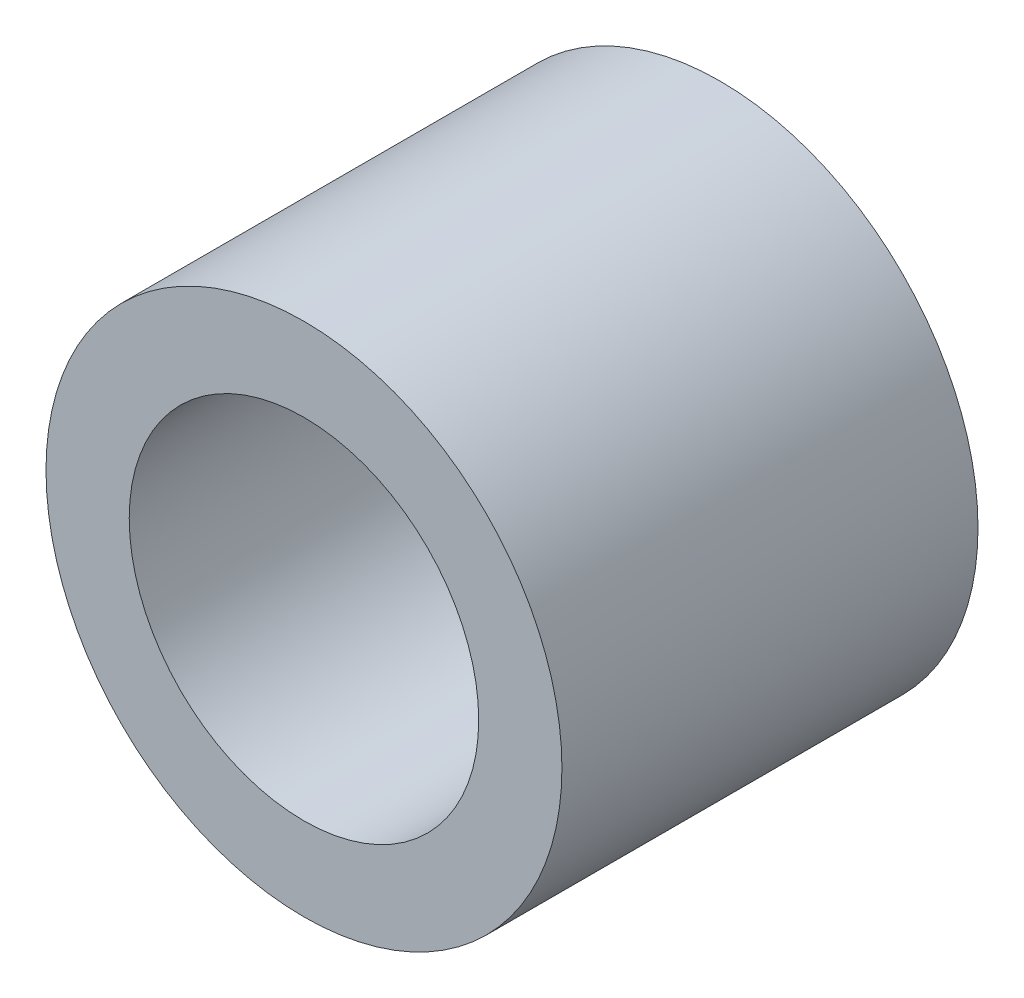
from build123d import *

# Parameters (mm, degrees)
SKETCH1_R           = 3.1
SKETCH1_R_2         = 2.1
BOSS_EXTRUDE1_DEPTH = 2.5


with BuildPart() as part:
    # Sketch1 → Boss-Extrude1 (new, symmetric)
    with BuildSketch(Plane.XY):
        Circle(SKETCH1_R)
        Circle(SKETCH1_R_2, mode=Mode.SUBTRACT)
    extrude(amount=BOSS_EXTRUDE1_DEPTH, both=True)


solid = part.part
